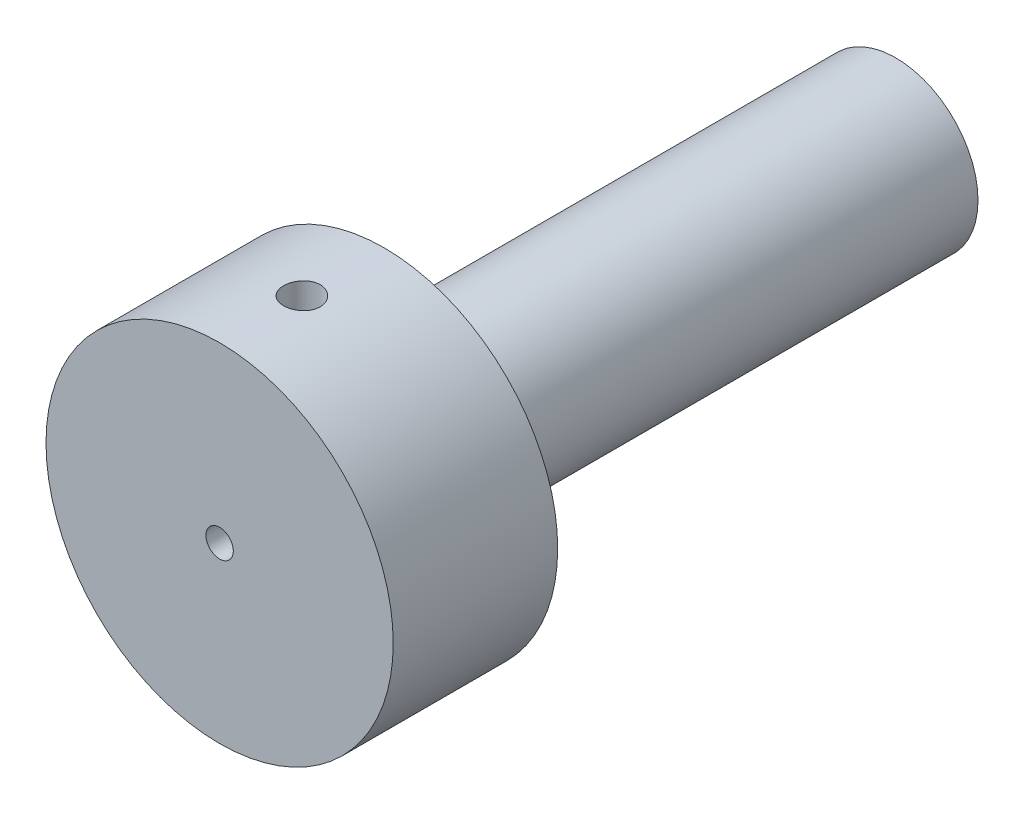
from build123d import *

# Parameters (mm, degrees)
SZKIC2_W = 56
SZKIC2_H = 9
SZKIC3_W = 18
SZKIC3_H = 19


with BuildPart() as part:
    # Szkic2 → Obrót1 (revolve)
    with BuildSketch(Plane(origin=(0, 0, 0), x_dir=(0, 0, -1), z_dir=(1, 0, 0))):
        with Locations((-28, 4.5)):
            Rectangle(SZKIC2_W, SZKIC2_H)
    revolve(axis=Axis((0, 0, 0), (0, 0, 1)))

    # Szkic3 → Obrót2 (revolve)
    with BuildSketch(Plane(origin=(0, 0, 0), x_dir=(0, 0, -1), z_dir=(1, 0, 0))):
        with Locations((-65, 9.5)):
            Rectangle(SZKIC3_W, SZKIC3_H)
    revolve(axis=Axis((0, 0, 56), (0, 0, 1)))

    # Szkic4 → Wycięcie-obrót1 (revolve, cut)
    with BuildSketch(Plane(origin=(0, 0, 0), x_dir=(0, 0, -1), z_dir=(1, 0, 0))):
        Polygon((-74, 0), (-74, 1.5), (0, 2.791674805), (0, 0), align=None)
    revolve(axis=Axis((0, 0, 0), (0, 0, 1)), mode=Mode.SUBTRACT)

    # Szkic5 → Wycięcie-obrót2 (revolve, cut)
    with BuildSketch(Plane(origin=(0, 0, 0), x_dir=(0, 0, -1), z_dir=(1, 0, 0))):
        Polygon((-65, 11.845299462), (-67, 13), (-67, 19), (-65, 19), align=None)
    revolve(axis=Axis((0, 19, 65), (0, -1, 0)), mode=Mode.SUBTRACT)

    # Szkic6 → Obrót3 (revolve)
    with BuildSketch(Plane(origin=(0, 0, 0), x_dir=(0, 0, -1), z_dir=(1, 0, 0))):
        with BuildLine():
            Line((-56, 9), (-53, 9))
            ThreePointArc((-53, 9), (-55.121320344, 9.878679656), (-56, 12))
            Line((-56, 12), (-56, 9))
        make_face()
    revolve(axis=Axis((0, 0, 0), (0, 0, 1)))

    # Szkic1 → Wycięcie-obrót3 (revolve, cut)
    with BuildSketch(Plane(origin=(0, -15, 0), x_dir=(1, 0, 0), z_dir=(0, 1, 0))):
        Polygon((0, -56), (2, -56), (2, -62), (0, -63.154700538), align=None)
    revolve(axis=Axis((0, -15, 63.154700538), (0, 0, -1)), mode=Mode.SUBTRACT)


solid = part.part
